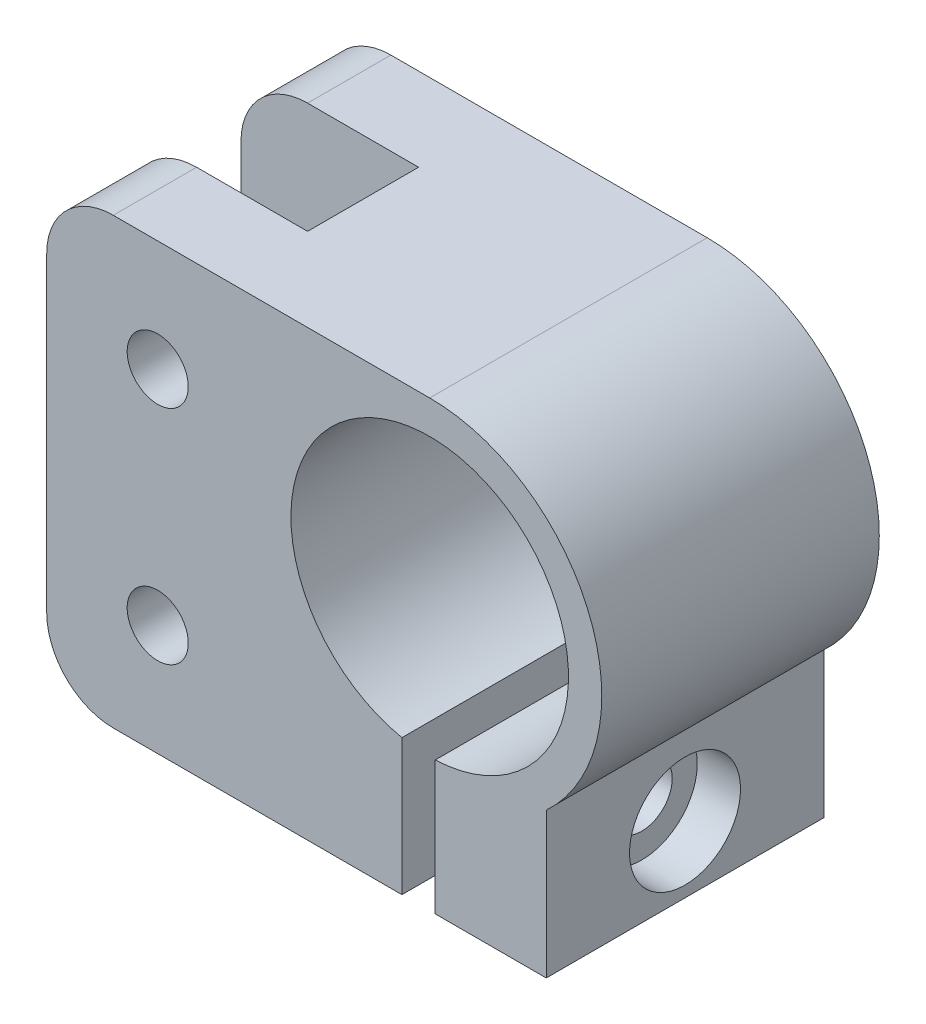
from build123d import *

# Parameters (mm, degrees)
RESSALTO_EXTRUS_O1_DEPTH                             = 12.5
ESBO_O2_W                                            = 16
ESBO_O2_H                                            = 10
CORTE_EXTRUS_O1_DEPTH                                = 51.124844139
FILETE1_R                                            = 6
ESBO_O5_R                                            = 12.5
CORTE_EXTRUS_O2_DEPTH                                = 43.20485754
ESBO_O7_W                                            = 3
ESBO_O7_H                                            = 15
CORTE_EXTRUS_O3_DEPTH                                = 43.20485754
REBAIXO_PARA_PARAFUSO_ALLEN_SEXTAVADO_DE_D           = 5.5
REBAIXO_PARA_PARAFUSO_ALLEN_SEXTAVADO_DE_DEPTH       = 27
REBAIXO_PARA_PARAFUSO_ALLEN_SEXTAVADO_DE_CBORE_D     = 10
REBAIXO_PARA_PARAFUSO_ALLEN_SEXTAVADO_DE_CBORE_DEPTH = 3.9
REBAIXO_PARA_PARAFUSO_ALLEN_SEXTAVADO_DE_TIP         = 1.652366702
REBAIXO_PARA_PARAFUSO_ALLEN_SEXTAVAD_2_D             = 5.5
REBAIXO_PARA_PARAFUSO_ALLEN_SEXTAVAD_2_DEPTH         = 27
REBAIXO_PARA_PARAFUSO_ALLEN_SEXTAVAD_2_CBORE_D       = 10
REBAIXO_PARA_PARAFUSO_ALLEN_SEXTAVAD_2_CBORE_DEPTH   = 3.9
REBAIXO_PARA_PARAFUSO_ALLEN_SEXTAVAD_2_TIP           = 1.652366702


with BuildPart() as part:
    # Esboço1 → Ressalto-extrusão1 (new, symmetric)
    with BuildSketch(Plane.XY):
        with BuildLine():
            Line((12, 20), (-22.5, 20))
            Line((-22.5, 20), (-22.5, -20))
            Line((-22.5, -20), (22.5, -20))
            Line((22.5, -20), (22.5, -6.901754251))
            ThreePointArc((22.5, -6.901754251), (26.439134165, 10.135725735), (12, 20))
        make_face()
    extrude(amount=RESSALTO_EXTRUS_O1_DEPTH, both=True)

    # Esboço2 → Corte-extrusão1 (cut, through all)
    with BuildSketch(Plane(origin=(0, 20, 0), x_dir=(1, 0, 0), z_dir=(0, 1, 0))):
        with Locations((-14.5, 0)):
            Rectangle(ESBO_O2_W, ESBO_O2_H)
    extrude(amount=-CORTE_EXTRUS_O1_DEPTH, mode=Mode.SUBTRACT)

    # Filete1
    filete1_edges = [part.edges().sort_by_distance(p)[0] for p in [
        (-22.5, 20, -8.75),
        (-22.5, -20, -8.75),
        (-22.5, 20, 8.75),
        (-22.5, -20, 8.75),
    ]]
    fillet(filete1_edges, radius=FILETE1_R)

    # Esboço5 → Corte-extrusão2 (cut, through all)
    with BuildSketch(Plane.XY.offset(12.5)):
        with Locations((12, 4.5)):
            Circle(ESBO_O5_R)
    extrude(amount=-CORTE_EXTRUS_O2_DEPTH, mode=Mode.SUBTRACT)

    # Esboço7 → Corte-extrusão3 (cut, through all)
    with BuildSketch(Plane(origin=(0, 0, -12.5), x_dir=(-1, 0, 0), z_dir=(0, 0, -1))):
        with Locations((-11, -12.5)):
            Rectangle(ESBO_O7_W, ESBO_O7_H)
    extrude(amount=-CORTE_EXTRUS_O3_DEPTH, mode=Mode.SUBTRACT)

    # Rebaixo para parafuso Allen sextavado de
    with Locations(Plane(origin=(22.5, 0, 0), x_dir=(0, 0, -1), z_dir=(1, 0, 0))):
        with Locations((0, -14)):
            CounterBoreHole(REBAIXO_PARA_PARAFUSO_ALLEN_SEXTAVADO_DE_D / 2, REBAIXO_PARA_PARAFUSO_ALLEN_SEXTAVADO_DE_CBORE_D / 2, REBAIXO_PARA_PARAFUSO_ALLEN_SEXTAVADO_DE_CBORE_DEPTH, depth=REBAIXO_PARA_PARAFUSO_ALLEN_SEXTAVADO_DE_DEPTH)
            with Locations((0, 0, -(REBAIXO_PARA_PARAFUSO_ALLEN_SEXTAVADO_DE_DEPTH + REBAIXO_PARA_PARAFUSO_ALLEN_SEXTAVADO_DE_TIP / 2))):  # 118° drill point
                Cone(0, REBAIXO_PARA_PARAFUSO_ALLEN_SEXTAVADO_DE_D / 2, REBAIXO_PARA_PARAFUSO_ALLEN_SEXTAVADO_DE_TIP, mode=Mode.SUBTRACT)

    # Rebaixo para parafuso Allen sextavad 2
    with Locations(Plane(origin=(0, 0, -12.5), x_dir=(-1, 0, 0), z_dir=(0, 0, -1))):
        with Locations((12.5, 10), (12.5, -10)):
            CounterBoreHole(REBAIXO_PARA_PARAFUSO_ALLEN_SEXTAVAD_2_D / 2, REBAIXO_PARA_PARAFUSO_ALLEN_SEXTAVAD_2_CBORE_D / 2, REBAIXO_PARA_PARAFUSO_ALLEN_SEXTAVAD_2_CBORE_DEPTH, depth=REBAIXO_PARA_PARAFUSO_ALLEN_SEXTAVAD_2_DEPTH)
            with Locations((0, 0, -(REBAIXO_PARA_PARAFUSO_ALLEN_SEXTAVAD_2_DEPTH + REBAIXO_PARA_PARAFUSO_ALLEN_SEXTAVAD_2_TIP / 2))):  # 118° drill point
                Cone(0, REBAIXO_PARA_PARAFUSO_ALLEN_SEXTAVAD_2_D / 2, REBAIXO_PARA_PARAFUSO_ALLEN_SEXTAVAD_2_TIP, mode=Mode.SUBTRACT)


solid = part.part
